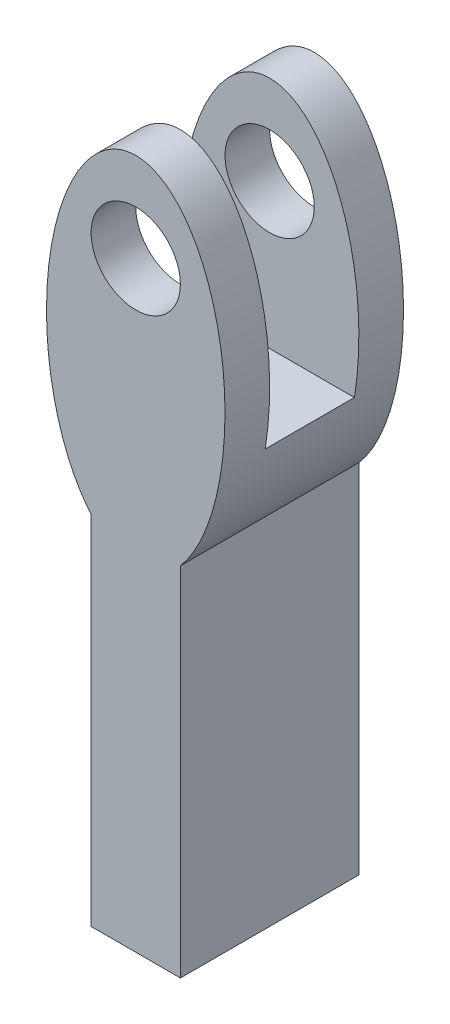
from build123d import *

# Parameters (mm, degrees)
BOSS_EXTRUDE1_DEPTH      = 25.4
BOSS_EXTRUDE1_DEPTH_BACK = 25.4
CUT_EXTRUDE1_REACH       = 158.28
SKETCH4_R                = 12.7
CUT_EXTRUDE2_DEPTH       = 12.7
CUT_EXTRUDE2_DEPTH_BACK  = 12.7


with BuildPart() as part:
    # Sketch3 → Boss-Extrude1 (new, two sides: drawn at the far end of the back side and taken through both)
    with BuildSketch(Plane.XY.offset(-BOSS_EXTRUDE1_DEPTH_BACK)):
        with BuildLine():
            Line((-12.7, -43.994090512), (-12.7, -145.594090512))
            Line((-12.7, -145.594090512), (12.7, -145.594090512))
            Line((12.7, -145.594090512), (12.7, -43.994090512))
            add(Edge.make_bspline(
                [(12.7, -43.994090512), (94.794090512, 50.8), (0, 50.8), (-94.794090512, 50.8), (-12.7, -43.994090512)],
                knots=[0.523598776, 0.523598776, 0.523598776, 3.141592654, 3.141592654, 5.759586532, 5.759586532, 5.759586532], degree=2, weights=[1, 0.258819045, 1, 0.258819045, 1]))
        make_face()
    extrude(amount=BOSS_EXTRUDE1_DEPTH + BOSS_EXTRUDE1_DEPTH_BACK)

    # Sketch4 → Cut-Extrude1 (cut, up to next)
    with BuildSketch(Plane.XY.offset(25.4), mode=Mode.PRIVATE) as cut_extrude1_sk1:
        with Locations((0, 25.4)):
            Circle(SKETCH4_R)
    cut_extrude1_tool1 = extrude(cut_extrude1_sk1.sketch, amount=-CUT_EXTRUDE1_REACH, mode=Mode.PRIVATE) & part.part
    add(cut_extrude1_tool1.solids().sort_by_distance((0, 25.4, 25.4))[0], mode=Mode.SUBTRACT)

    # Sketch5 → Cut-Extrude2 (cut, two sides: drawn at the far end of the back side and taken through both)
    with BuildSketch(Plane.XY.offset(-CUT_EXTRUDE2_DEPTH_BACK)):
        with BuildLine():
            Line((-24.13, -15.862294916), (24.13, -15.862294916))
            add(Edge.make_bspline(
                [(24.13, -15.862294916), (35.085418377, 50.8), (0, 50.8), (-35.085418377, 50.8), (-24.13, -15.862294916)],
                knots=[1.253235898, 1.253235898, 1.253235898, 3.141592654, 3.141592654, 5.02994941, 5.02994941, 5.02994941], degree=2, weights=[1, 0.586408603, 1, 0.586408603, 1]))
        make_face()
    extrude(amount=CUT_EXTRUDE2_DEPTH + CUT_EXTRUDE2_DEPTH_BACK, mode=Mode.SUBTRACT)


solid = part.part
